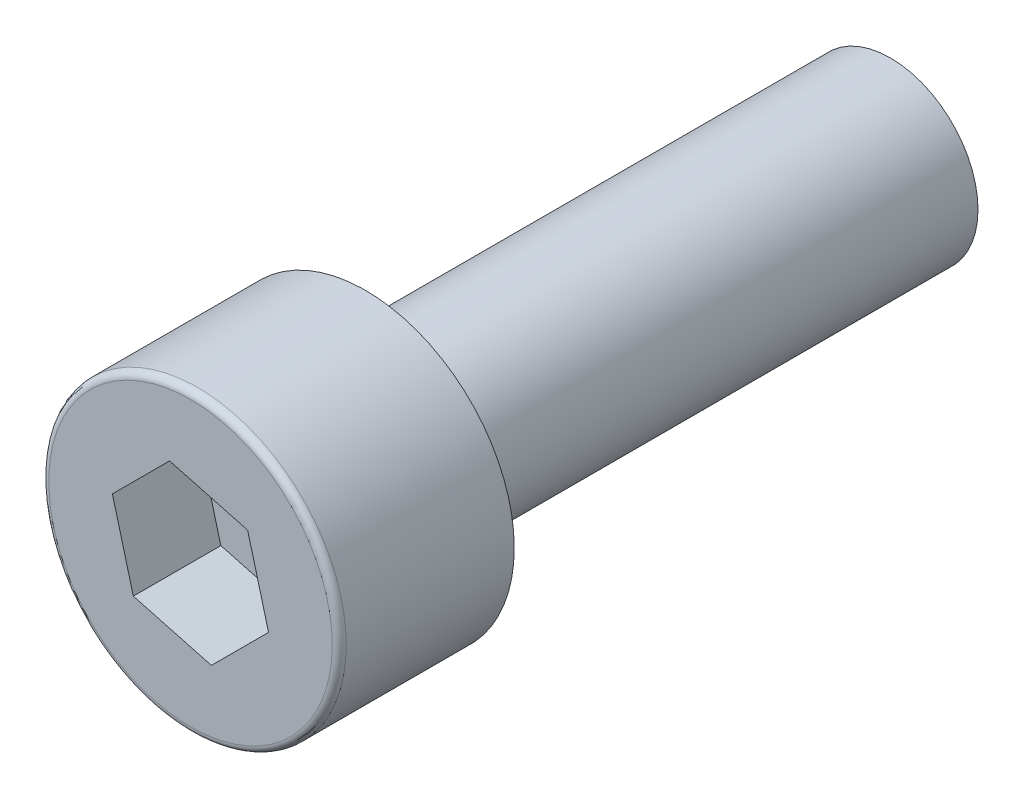
from build123d import *

# Parameters (mm, degrees)
SKETCH_1_R          = 4.25
EXTRUDE_1_DEPTH     = 5
CUT_EXTRUDE_1_DEPTH = 2.5
SKETCH_3_R          = 2.5
EXTRUDE_2_DEPTH     = 15
FILLET_1_R          = 0.2


with BuildPart() as part:
    # 草图1 → 凸台-拉伸1 (new body)
    with BuildSketch(Plane.XY):
        Circle(SKETCH_1_R)
    extrude(amount=EXTRUDE_1_DEPTH)

    # 草图2 → 切除-拉伸1 (cut)
    with BuildSketch(Plane.XY.offset(5)):
        Polygon((-1.632993162, -1.632993162), (0.597716981, -2.230710143), (2.230710143, -0.597716981), (1.632993162, 1.632993162), (-0.597716981, 2.230710143), (-2.230710143, 0.597716981), align=None)
    extrude(amount=-CUT_EXTRUDE_1_DEPTH, mode=Mode.SUBTRACT)

    # 草图3 → 凸台-拉伸2 (add)
    with BuildSketch(Plane(origin=(0, 0, 0), x_dir=(-1, 0, 0), z_dir=(0, 0, -1))):
        with Locations(Location((0, 0, 0), (0, 0, 180))):
            Circle(SKETCH_3_R)
    extrude(amount=EXTRUDE_2_DEPTH)

    # 圆角1
    fillet_1_edges = [part.edges().sort_by_distance(p)[0] for p in [
        (-4.25, 0, 5),
    ]]
    fillet(fillet_1_edges, radius=FILLET_1_R)


solid = part.part
